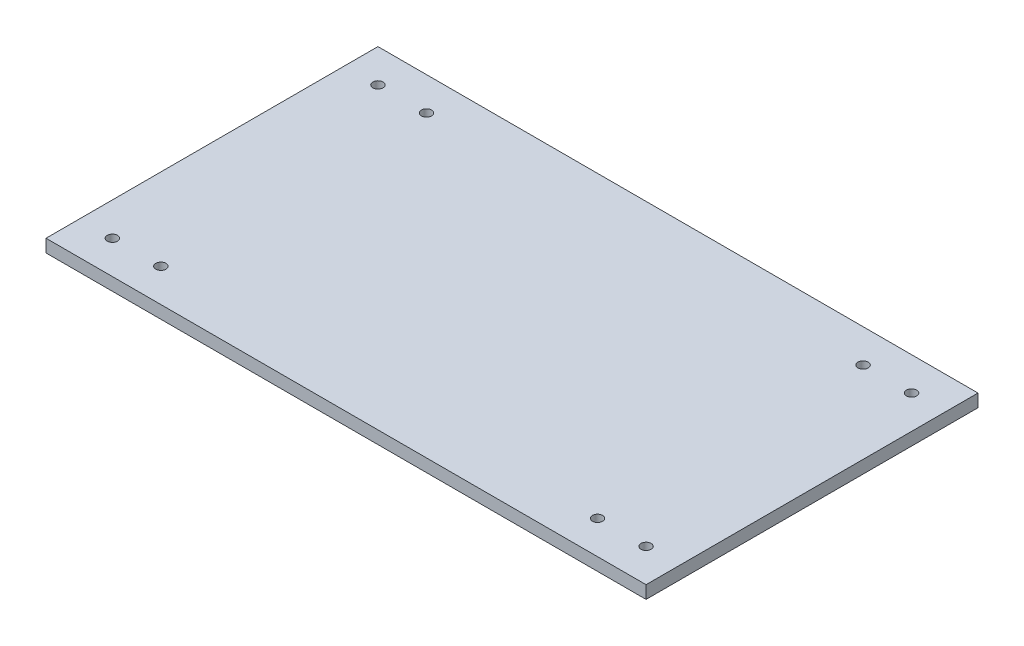
from build123d import *

# Parameters (mm, degrees)
SKETCH1_W           = 298.45
SKETCH1_H           = 165.1
BOSS_EXTRUDE1_DEPTH = 6.35
SKETCH2_R           = 2.54
CUT_EXTRUDE1_DEPTH  = 6.35
SKETCH5_R           = 2.54
CUT_EXTRUDE2_DEPTH  = 6.35
SKETCH6_R           = 2.54
CUT_EXTRUDE3_DEPTH  = 6.35
SKETCH7_R           = 2.54
CUT_EXTRUDE4_DEPTH  = 6.35


with BuildPart() as part:
    # Sketch1 → Boss-Extrude1 (new body)
    with BuildSketch(Plane(origin=(0, 0, 0), x_dir=(1, 0, 0), z_dir=(0, 1, 0))):
        Rectangle(SKETCH1_W, SKETCH1_H)
    extrude(amount=BOSS_EXTRUDE1_DEPTH)

    # Sketch2 → Cut-Extrude1 (cut)
    with BuildSketch(Plane(origin=(0, 6.35, 0), x_dir=(1, 0, 0), z_dir=(0, 1, 0))):
        with Locations(Location((132.715, -66.04, 0), (0, 0, 270))):
            Circle(SKETCH2_R)
        with Locations(Location((108.585, -66.04, 0), (0, 0, 270))):
            Circle(SKETCH2_R)
    extrude(amount=-CUT_EXTRUDE1_DEPTH, mode=Mode.SUBTRACT)

    # Sketch5 → Cut-Extrude2 (cut)
    with BuildSketch(Plane(origin=(0, 6.35, 0), x_dir=(1, 0, 0), z_dir=(0, 1, 0))):
        with Locations(Location((-132.715, -66.04, 0), (0, 0, 270))):
            Circle(SKETCH5_R)
        with Locations(Location((-108.585, -66.04, 0), (0, 0, 270))):
            Circle(SKETCH5_R)
    extrude(amount=-CUT_EXTRUDE2_DEPTH, mode=Mode.SUBTRACT)

    # Sketch6 → Cut-Extrude3 (cut)
    with BuildSketch(Plane(origin=(0, 6.35, 0), x_dir=(1, 0, 0), z_dir=(0, 1, 0))):
        with Locations(Location((132.715, 66.04, 0), (0, 0, 270))):
            Circle(SKETCH6_R)
        with Locations(Location((108.585, 66.04, 0), (0, 0, 270))):
            Circle(SKETCH6_R)
    extrude(amount=-CUT_EXTRUDE3_DEPTH, mode=Mode.SUBTRACT)

    # Sketch7 → Cut-Extrude4 (cut)
    with BuildSketch(Plane(origin=(0, 6.35, 0), x_dir=(1, 0, 0), z_dir=(0, 1, 0))):
        with Locations(Location((-132.715, 66.04, 0), (0, 0, 270))):
            Circle(SKETCH7_R)
        with Locations(Location((-108.585, 66.04, 0), (0, 0, 270))):
            Circle(SKETCH7_R)
    extrude(amount=-CUT_EXTRUDE4_DEPTH, mode=Mode.SUBTRACT)


solid = part.part
